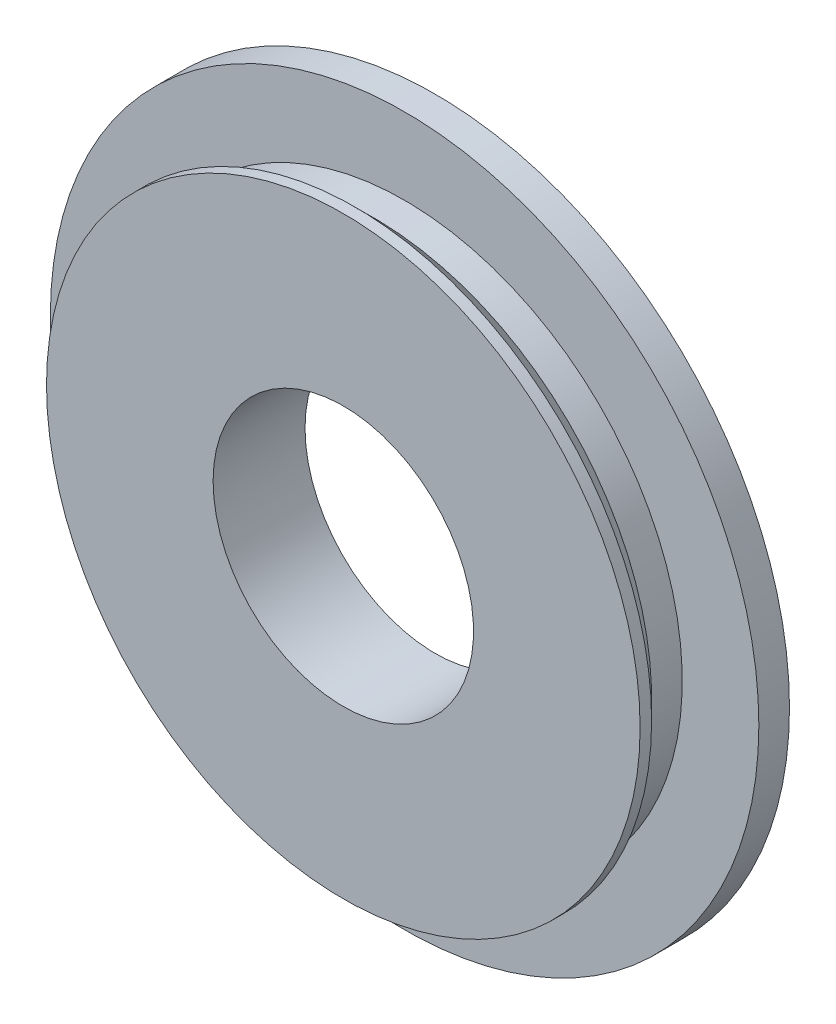
from build123d import *


with BuildPart() as part:
    # Sketch1 → Revolve1 (revolve)
    with BuildSketch(Plane(origin=(0, 0, 0), x_dir=(1, 0, 0), z_dir=(0, 1, 0)), mode=Mode.PRIVATE) as revolve1_sk:
        Polygon((3.4, 0), (9.25, 0), (9.25, -0.8), (7.25, -0.8), (7.25, -1.6), (7.75, -2.1), (7.75, -2.4), (3.4, -2.4), align=None)
    revolve(revolve1_sk.sketch.rotate(Axis((0, 0, -0.05147905), (0, 0, 1)), 180), axis=Axis((0, 0, -0.05147905), (0, 0, 1)))


solid = part.part
